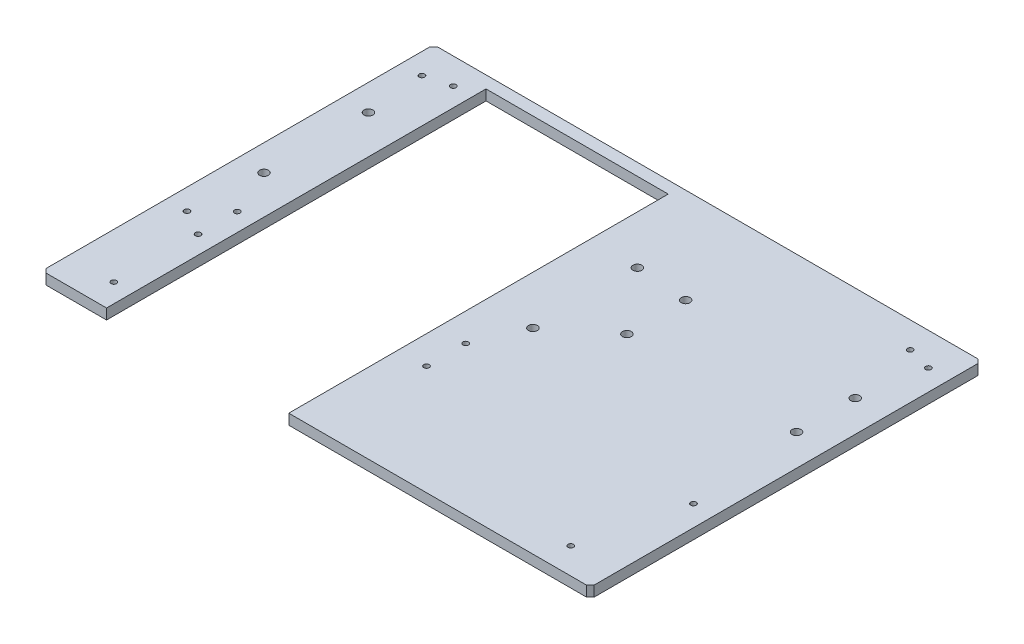
from build123d import *

# Parameters (mm, degrees)
SKETCH1_W             = 420
SKETCH1_H             = 300
BOSS_EXTRUDE1_DEPTH   = 4
CHAMFER1_SIZE         = 3
M8_TAPPED_HOLE1_D     = 6.8
M8_TAPPED_HOLE1_DEPTH = 19.75
M8_TAPPED_HOLE1_TIP   = 2.042926105
M5_TAPPED_HOLE1_D     = 4.2
M5_TAPPED_HOLE1_DEPTH = 12.4
M5_TAPPED_HOLE1_TIP   = 1.2618073
SKETCH6_W             = 139.582677991
SKETCH6_H             = 303.771276781
CUT_EXTRUDE1_DEPTH    = 10


with BuildPart() as part:
    # Sketch1 → Boss-Extrude1 (new, symmetric)
    with BuildSketch(Plane(origin=(0, 0, 0), x_dir=(1, 0, 0), z_dir=(0, 1, 0))):
        Rectangle(SKETCH1_W, SKETCH1_H)
    extrude(amount=BOSS_EXTRUDE1_DEPTH, both=True)

    # Chamfer1
    chamfer1_edges = [part.edges().sort_by_distance(p)[0] for p in [
        (210, 0, 150),
        (-210, 0, 150),
        (-210, 0, -150),
        (210, 0, -150),
    ]]
    chamfer(chamfer1_edges, length=CHAMFER1_SIZE)

    # M8 Tapped Hole1
    with Locations(Plane(origin=(-190, 4, -80), x_dir=(0, 0, 1), z_dir=(0, 1, 0))):
        with Locations((0, 0), (0, 206), (80, 206), (80, 0), (48, 246), (48, 376), (3, 376), (3, 246)):
            Hole(M8_TAPPED_HOLE1_D / 2, depth=M8_TAPPED_HOLE1_DEPTH)
            with Locations((0, 0, -(M8_TAPPED_HOLE1_DEPTH + M8_TAPPED_HOLE1_TIP / 2))):  # 118° drill point
                Cone(0, M8_TAPPED_HOLE1_D / 2, M8_TAPPED_HOLE1_TIP, mode=Mode.SUBTRACT)

    # M5 Tapped Hole1
    with Locations(Plane(origin=(0, 4, 0), x_dir=(-1, 0, 0), z_dir=(0, 1, 0))):
        with Locations((175, 130), (-175, 130), (-175, -130), (175, -130), (194, -125), (194, 55), (-194, 55), (-194, -125), (174.5, 66), (174.5, 36), (-0.5, 36), (-0.5, 66)):
            Hole(M5_TAPPED_HOLE1_D / 2, depth=M5_TAPPED_HOLE1_DEPTH)
            with Locations((0, 0, -(M5_TAPPED_HOLE1_DEPTH + M5_TAPPED_HOLE1_TIP / 2))):  # 118° drill point
                Cone(0, M5_TAPPED_HOLE1_D / 2, M5_TAPPED_HOLE1_TIP, mode=Mode.SUBTRACT)

    # Sketch6 → Cut-Extrude1 (cut)
    with BuildSketch(Plane(origin=(0, 4, 0), x_dir=(1, 0, 0), z_dir=(0, 1, 0))):
        with Locations((-90.81821677, -11.184509455)):
            Rectangle(SKETCH6_W, SKETCH6_H)
    extrude(amount=-CUT_EXTRUDE1_DEPTH, mode=Mode.SUBTRACT)


solid = part.part
